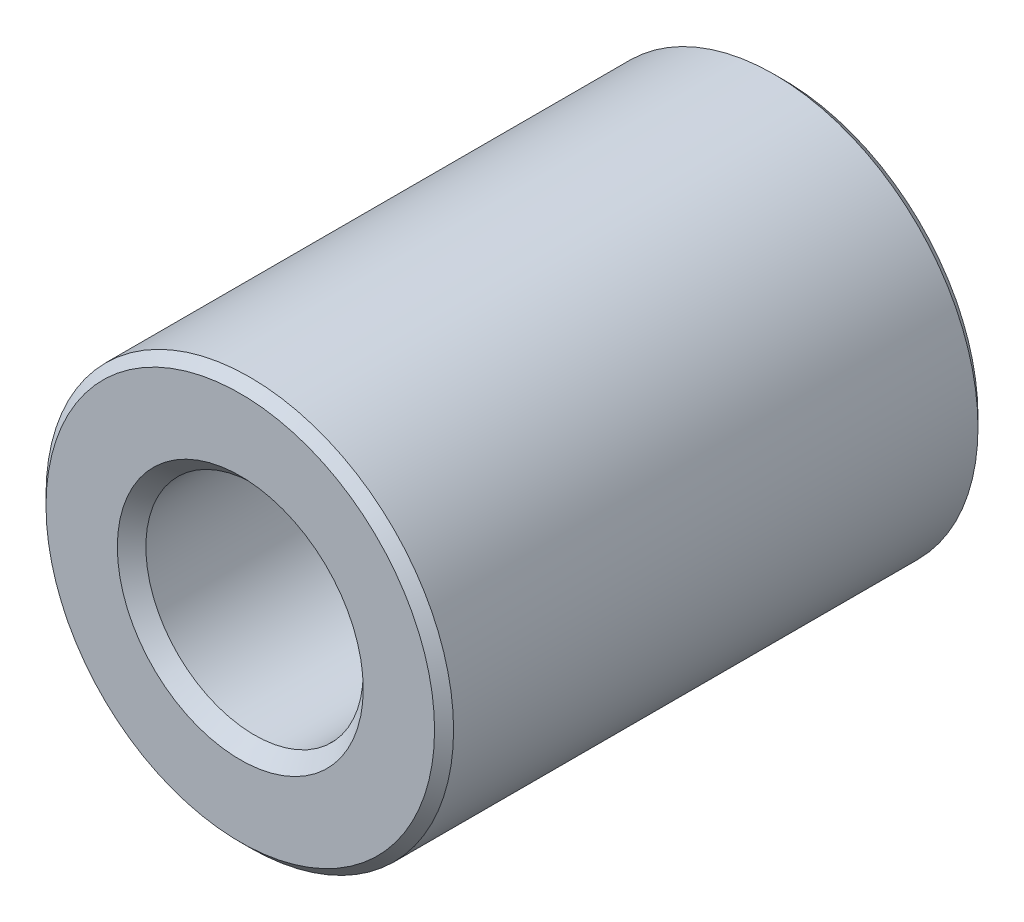
from build123d import *

# Parameters (mm, degrees)
BOSS_EXTRUDE1_DEPTH      = 4
BOSS_EXTRUDE1_DEPTH_BACK = 4
SKETCH3_R                = 3
SKETCH3_R_2              = 1.6
CHAMFER1_SIZE            = 0.14
CHAMFER2_SIZE            = 0.21


with BuildPart() as part:
    # Sketch3 → Boss-Extrude1 (new, two sides: drawn at the far end of the back side and taken through both)
    with BuildSketch(Plane.XY.offset(-BOSS_EXTRUDE1_DEPTH_BACK)):
        Circle(SKETCH3_R)
        Circle(SKETCH3_R_2, mode=Mode.SUBTRACT)
    extrude(amount=BOSS_EXTRUDE1_DEPTH + BOSS_EXTRUDE1_DEPTH_BACK)

    # Chamfer1
    chamfer1_edges = [part.edges().sort_by_distance(p)[0] for p in [
        (-3, 0, -4),
        (-3, 0, 4),
    ]]
    chamfer(chamfer1_edges, length=CHAMFER1_SIZE)

    # Chamfer2
    chamfer2_edges = [part.edges().sort_by_distance(p)[0] for p in [
        (-1.6, 0, -4),
        (-1.6, 0, 4),
    ]]
    chamfer(chamfer2_edges, length=CHAMFER2_SIZE)


solid = part.part
